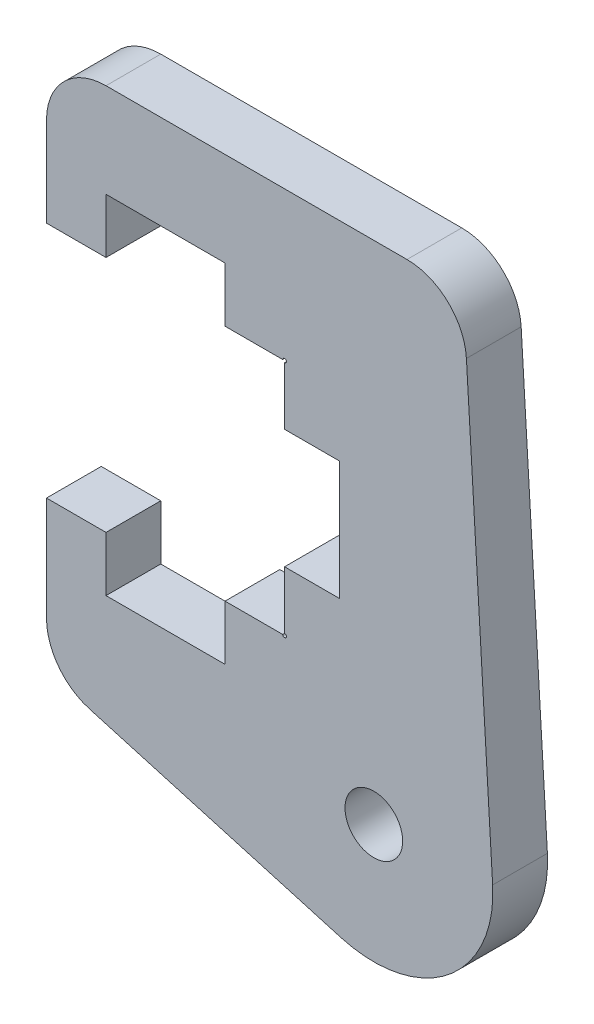
from build123d import *

# Parameters (mm, degrees)
SKETCH1_R           = 3.075
BOSS_EXTRUDE1_DEPTH = 5.842
FILLET1_R           = 6.35
SKETCH2_R           = 0.1984375
CUT_EXTRUDE1_DEPTH  = 53.014369063


with BuildPart() as part:
    # Sketch1 → Boss-Extrude1 (new body)
    with BuildSketch(Plane.XY):
        with BuildLine():
            Line((12.7, -12.7), (6.35, -12.7))
            Line((6.35, -12.7), (6.35, -18.542))
            Line((6.35, -18.542), (-6.35, -18.542))
            Line((-6.35, -18.542), (-6.35, -12.7))
            Line((-6.35, -12.7), (-12.7, -12.7))
            Line((-12.7, -12.7), (-12.7, -28.575))
            Line((-12.7, -28.575), (18.716430351, -37.605733858))
            ThreePointArc((18.716430351, -37.605733858), (30.161479232, -35.314751505), (34.902776944, -24.649019461))
            Line((34.902776944, -24.649019461), (31.75, 28.575))
            Line((31.75, 28.575), (-12.7, 28.575))
            Line((-12.7, 28.575), (-12.7, 12.7))
            Line((-12.7, 12.7), (-6.35, 12.7))
            Line((-6.35, 12.7), (-6.35, 18.542))
            Line((-6.35, 18.542), (6.35, 18.542))
            Line((6.35, 18.542), (6.35, 12.7))
            Line((6.35, 12.7), (12.7, 12.7))
            Line((12.7, 12.7), (12.7, 6.35))
            Line((12.7, 6.35), (18.542, 6.35))
            Line((18.542, 6.35), (18.542, -6.35))
            Line((18.542, -6.35), (12.7, -6.35))
            Line((12.7, -6.35), (12.7, -12.7))
        make_face()
        with Locations((22.225, -25.4)):
            Circle(SKETCH1_R, mode=Mode.SUBTRACT)
    extrude(amount=BOSS_EXTRUDE1_DEPTH)

    # Fillet1
    fillet1_edges = [part.edges().sort_by_distance(p)[0] for p in [
        (-12.7, 28.575, 2.921),
        (31.75, 28.575, 2.921),
        (-12.7, -28.575, 2.921),
    ]]
    fillet(fillet1_edges, radius=FILLET1_R)

    # Sketch2 → Cut-Extrude1 (cut, through all)
    with BuildSketch(Plane.XY.offset(5.842)):
        with Locations((12.7, 12.7)):
            Circle(SKETCH2_R)
        with Locations((12.7, -12.7)):
            Circle(SKETCH2_R)
    extrude(amount=-CUT_EXTRUDE1_DEPTH, mode=Mode.SUBTRACT)


solid = part.part
